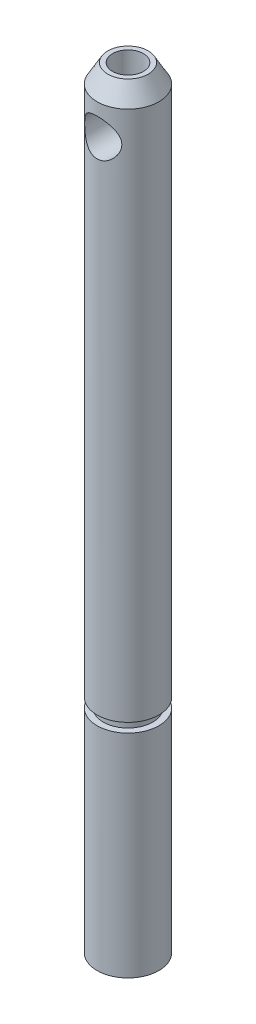
from build123d import *

# Parameters (mm, degrees)
SKETCH3_R                 = 2.5
BOSS_EXTRUDE1_DEPTH       = 62.34264779
CHAMFER1_SIZE             = 1.5
CHAMFER1_SIZE2            = 0.866025404
M3X0_5_TAPPED_HOLE1_D     = 2.5
M3X0_5_TAPPED_HOLE1_DEPTH = 4
M3X0_5_TAPPED_HOLE1_TIP   = 0.751075774
CUT_EXTRUDE1_DEPTH        = 63.442819711
CUT_EXTRUDE1_DEPTH_BACK   = 63.442819711
SKETCH7_R                 = 1.5
CUT_EXTRUDE2_DEPTH        = 63.442819819
CUT_EXTRUDE2_DEPTH_BACK   = 63.442819819
SKETCH8_W                 = 1
SKETCH8_H                 = 6
SKETCH9_R                 = 3
SKETCH9_R_2               = 2
CUT_EXTRUDE3_DEPTH        = 0.75


with BuildPart() as part:
    # Sketch3 → Boss-Extrude1 (new body)
    with BuildSketch(Plane(origin=(0, 0, 0), x_dir=(1, 0, 0), z_dir=(0, 1, 0))):
        with Locations(Location((0, 0, 0), (0, 0, 270))):
            Circle(SKETCH3_R)
    extrude(amount=BOSS_EXTRUDE1_DEPTH)

    # Chamfer1
    chamfer1_edges = [part.edges().sort_by_distance(p)[0] for p in [
        (0, 62.34264779, -2.5),
    ]]
    chamfer1_side = [part.faces().sort_by_distance(p)[0] for p in [
        (0, 31.171323895, -2.5),
    ]]
    chamfer(chamfer1_edges, length=CHAMFER1_SIZE, length2=CHAMFER1_SIZE2, reference=chamfer1_side[0])

    # M3x0.5 Tapped Hole1
    with Locations(Plane(origin=(0, 62.34264779, 0), x_dir=(1, 0, 0), z_dir=(0, 1, 0))):
        with Locations((0, 0)):
            Hole(M3X0_5_TAPPED_HOLE1_D / 2, depth=M3X0_5_TAPPED_HOLE1_DEPTH)
            with Locations((0, 0, -(M3X0_5_TAPPED_HOLE1_DEPTH + M3X0_5_TAPPED_HOLE1_TIP / 2))):  # 118° drill point
                Cone(0, M3X0_5_TAPPED_HOLE1_D / 2, M3X0_5_TAPPED_HOLE1_TIP, mode=Mode.SUBTRACT)

    # Sketch7 → Cut-Extrude1 (cut, two sides: drawn at the far end of the back side and taken through both)
    with BuildSketch(Plane.XY.offset(-CUT_EXTRUDE1_DEPTH_BACK)):
        with Locations(Location((0, 58.34264779, 0), (0, 0, 90.000000002))):
            Circle(SKETCH7_R)
    extrude(amount=CUT_EXTRUDE1_DEPTH + CUT_EXTRUDE1_DEPTH_BACK, mode=Mode.SUBTRACT)

    # Sketch8 → Cut-Extrude2 (cut, two sides: drawn at the far end of the back side and taken through both)
    with BuildSketch(Plane.XY.offset(-CUT_EXTRUDE2_DEPTH_BACK)):
        with Locations((-2, 3)):
            Rectangle(SKETCH8_W, SKETCH8_H)
    extrude(amount=CUT_EXTRUDE2_DEPTH + CUT_EXTRUDE2_DEPTH_BACK, mode=Mode.SUBTRACT)

    # Sketch9 → Cut-Extrude3 (cut)
    with BuildSketch(Plane(origin=(0, 17.15, 0), x_dir=(1, 0, 0), z_dir=(0, 1, 0))):
        Circle(SKETCH9_R)
        with Locations(Location((0, 0, 0), (0, 0, 270))):
            Circle(SKETCH9_R_2, mode=Mode.SUBTRACT)
    extrude(amount=CUT_EXTRUDE3_DEPTH, mode=Mode.SUBTRACT)


solid = part.part
